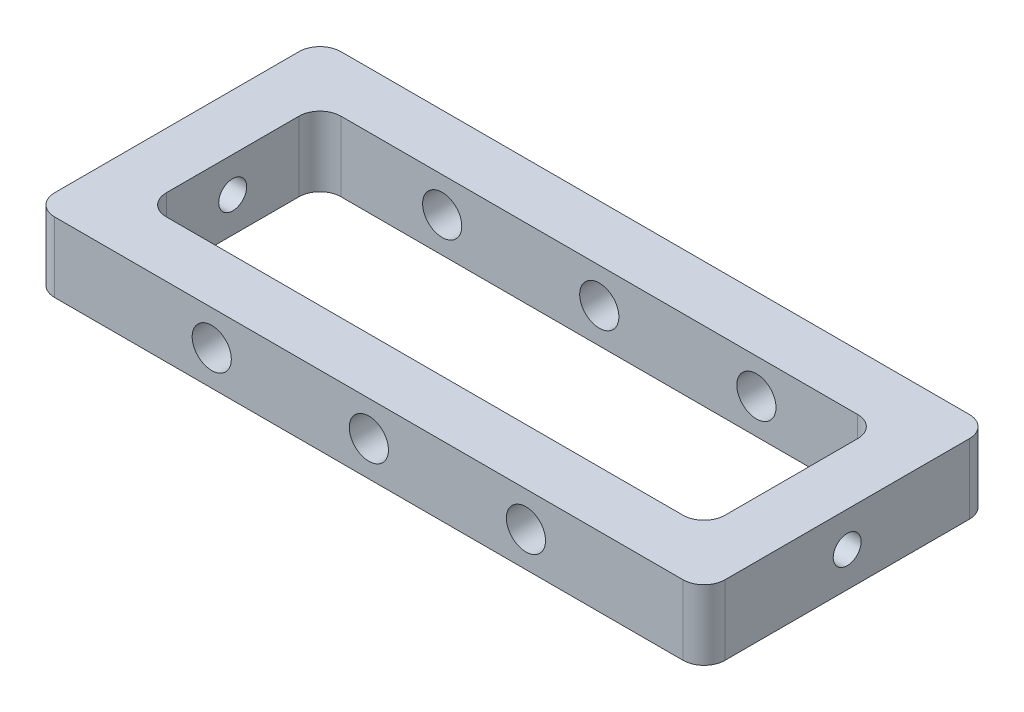
from build123d import *

# Parameters (mm, degrees)
SKETCH1_W           = 96
SKETCH1_H           = 41
SKETCH1_W_2         = 80
SKETCH1_H_2         = 25
BOSS_EXTRUDE1_DEPTH = 10
FILLET1_R           = 3
SKETCH2_R           = 2
CUT_EXTRUDE1_DEPTH  = 99.672437894
SKETCH3_R           = 2.80429848
CUT_EXTRUDE5_DEPTH  = 64.914004725
FILLET2_R           = 3


with BuildPart() as part:
    # Sketch1 → Boss-Extrude1 (new body)
    with BuildSketch(Plane(origin=(0, 0, 0), x_dir=(1, 0, 0), z_dir=(0, 1, 0))):
        Rectangle(SKETCH1_W, SKETCH1_H)
        Rectangle(SKETCH1_W_2, SKETCH1_H_2, mode=Mode.SUBTRACT)
    extrude(amount=BOSS_EXTRUDE1_DEPTH)

    # Fillet1
    fillet1_edges = [part.edges().sort_by_distance(p)[0] for p in [
        (48, 5, 20.5),
        (-48, 5, 20.5),
        (-48, 5, -20.5),
        (48, 5, -20.5),
    ]]
    fillet(fillet1_edges, radius=FILLET1_R)

    # Sketch2 → Cut-Extrude1 (cut, through all)
    with BuildSketch(Plane.ZY.offset(48)):
        with Locations((0, 5)):
            Circle(SKETCH2_R)
    extrude(amount=-CUT_EXTRUDE1_DEPTH, mode=Mode.SUBTRACT)

    # Sketch3 → Cut-Extrude5 (cut, through all)
    with BuildSketch(Plane.XY.offset(20.5)):
        with Locations((-22.5, 5)):
            Circle(SKETCH3_R)
        with Locations((0, 5)):
            Circle(SKETCH3_R)
        with Locations((22.5, 5)):
            Circle(SKETCH3_R)
    extrude(amount=-CUT_EXTRUDE5_DEPTH, mode=Mode.SUBTRACT)

    # Fillet2
    fillet2_edges = [part.edges().sort_by_distance(p)[0] for p in [
        (40, 5, 12.5),
        (40, 5, -12.5),
        (-40, 5, -12.5),
        (-40, 5, 12.5),
    ]]
    fillet(fillet2_edges, radius=FILLET2_R)


solid = part.part
